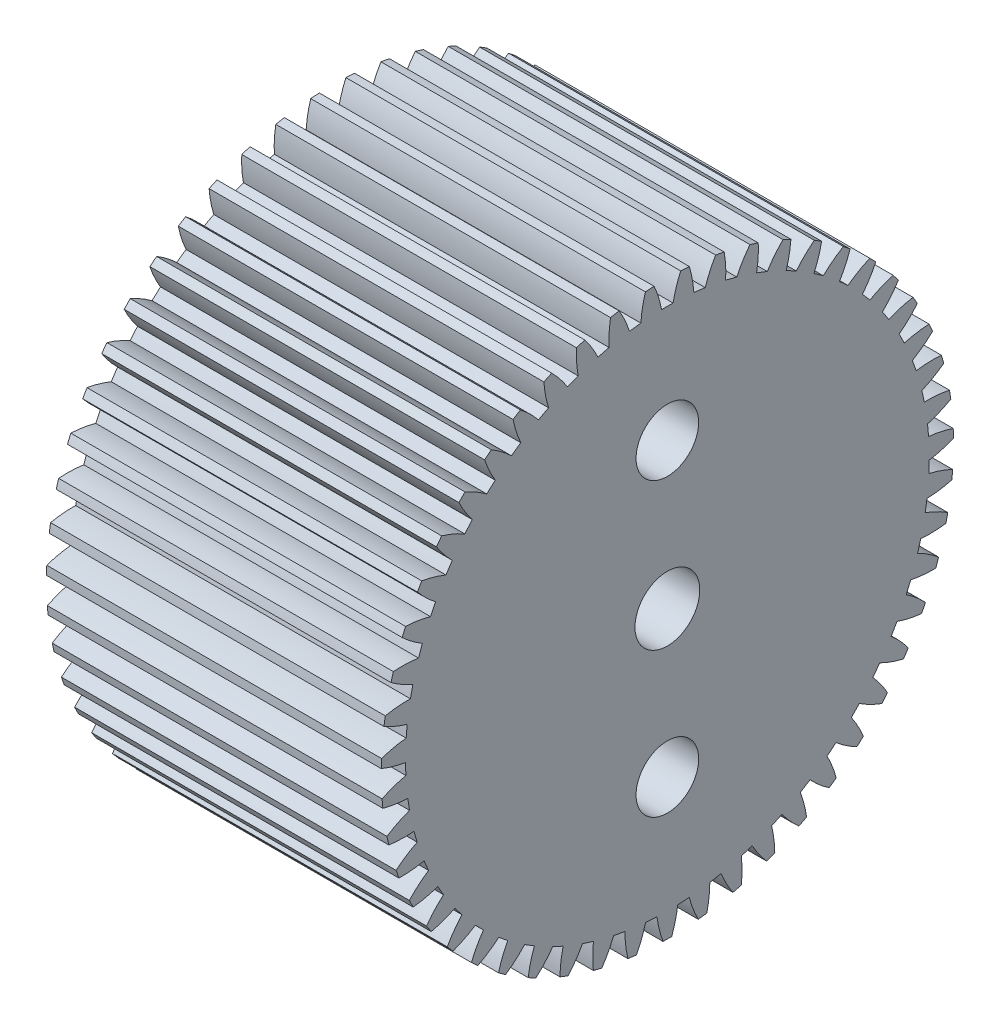
from build123d import *

# Parameters (mm, degrees)
BASPROSKE_W         = 8
BASPROSKE_H         = 13.25
TOOTHCUT_DEPTH      = 21.374616561
TEETHCUTS_COUNT     = 51
TEETHCUTS_ANGLE     = 352.941176471
BORSKE_R            = 1.5
BORE_DEPTH          = 50.0000508
CUT_EXTRUDE_1_REACH = 22.374
SKETCH_1_R          = 1.45
SKETCH_2_R          = 1.45
SKETCH_2_R_2        = 1.5
EXTRUDE_1_DEPTH     = 7.5


with BuildPart() as part:
    # BasProSke → Base-Revolve (revolve)
    with BuildSketch(Plane(origin=(0, 0, 0), x_dir=(1, 0, 0), z_dir=(0, 1, 0)), mode=Mode.PRIVATE) as base_revolve_sk:
        with Locations((4, 6.625)):
            Rectangle(BASPROSKE_W, BASPROSKE_H)
    revolve(base_revolve_sk.sketch.rotate(Axis((-10, 0, 0), (1, 0, 0)), 180), axis=Axis((-10, 0, 0), (1, 0, 0)))

    # TooCutSke → ToothCut (cut, through all)
    with BuildSketch(Plane(origin=(0, 0, 0), x_dir=(0, 0, -1), z_dir=(1, 0, 0))):
        with BuildLine():
            ThreePointArc((0.265457967, 12.121093518), (0, 12.124), (-0.265457967, 12.121093518))
            ThreePointArc((-0.265457967, 12.121093518), (-0.412560546, 12.701466693), (-0.626666111, 13.260600844))
            ThreePointArc((-0.626666111, 13.260600844), (0, 13.2754), (0.626666111, 13.260600844))
            ThreePointArc((0.626666111, 13.260600844), (0.412560546, 12.701466693), (0.265457967, 12.121093518))
        make_face()
    toothcut = extrude(amount=TOOTHCUT_DEPTH, mode=Mode.SUBTRACT)

    # TeethCuts: ToothCut ×51 about axis
    teethcuts_axis = Axis((-10, 0, 0), (1, 0, 0))
    for i in range(1, TEETHCUTS_COUNT):
        add(toothcut.rotate(teethcuts_axis, i * TEETHCUTS_ANGLE / (TEETHCUTS_COUNT - 1)), mode=Mode.SUBTRACT)

    # BorSke → Bore (cut, symmetric)
    with BuildSketch(Plane(origin=(0, 0, 0), x_dir=(0, 0, -1), z_dir=(1, 0, 0))):
        with Locations(Location((0, 0, 0), (0, 0, 180))):
            Circle(BORSKE_R)
    extrude(amount=BORE_DEPTH, both=True, mode=Mode.SUBTRACT)

    # 草圖1 → 除料-伸長1 (cut, up to next)
    with BuildSketch(Plane(origin=(8, 0, 0), x_dir=(0, 0, -1), z_dir=(1, 0, 0)), mode=Mode.PRIVATE) as cut_extrude_1_sk1:
        with Locations((0, 6.75)):
            Circle(SKETCH_1_R)
    cut_extrude_1_tool1 = extrude(cut_extrude_1_sk1.sketch, amount=-CUT_EXTRUDE_1_REACH, mode=Mode.PRIVATE) & part.part
    # 草圖1 → 除料-伸長1 (cut, up to next)
    with BuildSketch(Plane(origin=(8, 0, 0), x_dir=(0, 0, -1), z_dir=(1, 0, 0)), mode=Mode.PRIVATE) as cut_extrude_1_sk2:
        with Locations((0, -6.75)):
            Circle(SKETCH_1_R)
    cut_extrude_1_tool2 = extrude(cut_extrude_1_sk2.sketch, amount=-CUT_EXTRUDE_1_REACH, mode=Mode.PRIVATE) & part.part
    add(cut_extrude_1_tool1.solids().sort_by_distance((8, 6.75, 0))[0], mode=Mode.SUBTRACT)
    add(cut_extrude_1_tool2.solids().sort_by_distance((8, -6.75, 0))[0], mode=Mode.SUBTRACT)

    # 草圖2 → 填料-伸長1 (add)
    with BuildSketch(Plane.ZY):
        with BuildLine():
            ThreePointArc((12.123519516, -0.107937719), (12.695011661, 0.017518645), (13.248373473, 0.207606195))
            ThreePointArc((13.248373473, 0.207606195), (13.243715786, 0.408034526), (13.236026089, 0.608369441))
            ThreePointArc((13.236026089, 0.608369441), (12.672011861, 0.764031003), (12.093880441, 0.854067844))
            ThreePointArc((12.093880441, 0.854067844), (12.072281153, 1.11866159), (12.044893699, 1.382718984))
            ThreePointArc((12.044893699, 1.382718984), (12.596637106, 1.577454146), (13.122445184, 1.834102616))
            ThreePointArc((13.122445184, 1.834102616), (13.093192505, 2.032439427), (13.060942276, 2.230310932))
            ThreePointArc((13.060942276, 2.230310932), (12.482074005, 2.315481914), (11.897260054, 2.33379074))
            ThreePointArc((11.897260054, 2.33379074), (11.843309005, 2.593724701), (11.783679571, 2.852415076))
            ThreePointArc((11.783679571, 2.852415076), (12.307310374, 3.113477049), (12.797594002, 3.432795911))
            ThreePointArc((12.797594002, 3.432795911), (12.744189772, 3.626034618), (12.687867893, 3.818443183))
            ThreePointArc((12.687867893, 3.818443183), (12.102920632, 3.83183248), (11.520289331, 3.778135747))
            ThreePointArc((11.520289331, 3.778135747), (11.434804364, 4.029469589), (11.343836873, 4.278871464))
            ThreePointArc((11.343836873, 4.278871464), (11.831417361, 4.602302815), (12.27874434, 4.979451519))
            ThreePointArc((12.27874434, 4.979451519), (12.201998113, 5.164662821), (12.122458365, 5.348691727))
            ThreePointArc((12.122458365, 5.348691727), (11.540299318, 5.290096371), (10.968682766, 5.165208068))
            ThreePointArc((10.968682766, 5.165208068), (10.852959744, 5.404131825), (10.732033171, 5.640464522))
            ThreePointArc((10.732033171, 5.640464522), (11.176172122, 6.021362361), (11.573761431, 6.450623718))
            ThreePointArc((11.573761431, 6.450623718), (11.4748366, 6.625), (11.373284725, 6.797859557))
            ThreePointArc((11.373284725, 6.797859557), (10.802738831, 6.668167794), (10.250802151, 6.473981099))
            ThreePointArc((10.250802151, 6.473981099), (10.106595318, 6.696872932), (9.957542785, 6.916553888))
            ThreePointArc((9.957542785, 6.916553888), (10.351507505, 7.349144191), (10.693332095, 7.824011036))
            ThreePointArc((10.693332095, 7.824011036), (10.573728261, 7.984908932), (10.451703682, 8.143978766))
            ThreePointArc((10.451703682, 8.143978766), (9.901419834, 7.94515659), (9.377529824, 7.684615176))
            ThreePointArc((9.377529824, 7.684615176), (9.20702521, 7.888096272), (9.032106202, 8.087795346))
            ThreePointArc((9.032106202, 8.087795346), (9.369924587, 8.565520487), (9.650802746, 9.078794323))
            ThreePointArc((9.650802746, 9.078794323), (9.512332981, 9.223774784), (9.371685466, 9.366643557))
            ThreePointArc((9.371685466, 9.366643557), (8.850005406, 9.101704911), (8.362103704, 8.77875832))
            ThreePointArc((8.362103704, 8.77875832), (8.167885984, 8.959744112), (7.969752095, 9.136434072))
            ThreePointArc((7.969752095, 9.136434072), (8.246303163, 9.652052223), (8.461977064, 10.195952342))
            ThreePointArc((8.461977064, 10.195952342), (8.306740428, 10.322817612), (8.14960205, 10.447319581))
            ThreePointArc((8.14960205, 10.447319581), (7.664433917, 10.120280664), (7.219916616, 9.739824437))
            ThreePointArc((7.219916616, 9.739824437), (7.004929932, 9.895571365), (6.78658467, 10.04657377))
            ThreePointArc((6.78658467, 10.04657377), (6.997676188, 10.592268687), (7.144876436, 11.158550117))
            ThreePointArc((7.144876436, 11.158550117), (6.975226158, 11.265377048), (6.803978975, 11.369624889))
            ThreePointArc((6.803978975, 11.369624889), (6.362677422, 10.985443277), (5.968282951, 10.553244744))
            ThreePointArc((5.968282951, 10.553244744), (5.735786283, 10.681391844), (5.500539539, 10.804417651))
            ThreePointArc((5.500539539, 10.804417651), (5.642971576, 11.371917154), (5.719466764, 11.951995647))
            ThreePointArc((5.719466764, 11.951995647), (5.53797457, 12.037164852), (5.355214514, 12.119578273))
            ThreePointArc((5.355214514, 12.119578273), (4.964469224, 11.684077768), (4.626176201, 11.206688617))
            ThreePointArc((4.626176201, 11.206688617), (4.379693961, 11.305293309), (4.131111836, 11.398477574))
            ThreePointArc((4.131111836, 11.398477574), (4.202725267, 11.979178949), (4.207355805, 12.564261105))
            ThreePointArc((4.207355805, 12.564261105), (4.016772932, 12.626481506), (3.82527046, 12.685811204))
            ThreePointArc((3.82527046, 12.685811204), (3.491004732, 12.205593551), (3.213941335, 11.690250515))
            ThreePointArc((3.213941335, 11.690250515), (2.957209943, 11.757818052), (2.699060689, 11.819748195))
            ThreePointArc((2.699060689, 11.819748195), (2.698769927, 12.404848603), (2.631465622, 12.986065173))
            ThreePointArc((2.631465622, 12.986065173), (2.434681111, 13.024393571), (2.237339205, 13.059740169))
            ThreePointArc((2.237339205, 13.059740169), (1.964620168, 12.542084977), (1.752986394, 11.996600131))
            ThreePointArc((1.752986394, 11.996600131), (1.489897636, 12.032106259), (1.226094533, 12.061843483))
            ThreePointArc((1.226094533, 12.061843483), (1.153903986, 12.642473396), (1.015685102, 13.21101373))
            ThreePointArc((1.015685102, 13.21101373), (0.815682006, 13.224869106), (0.615492168, 13.235696785))
            ThreePointArc((0.615492168, 13.235696785), (0.408453964, 12.688451179), (0.265457967, 12.121093518))
            ThreePointArc((0.265457967, 12.121093518), (0, 12.124), (-0.265457967, 12.121093518))
            ThreePointArc((-0.265457967, 12.121093518), (-0.408453964, 12.688451179), (-0.615492168, 13.235696785))
            ThreePointArc((-0.615492168, 13.235696785), (-0.815682006, 13.224869106), (-1.015685102, 13.21101373))
            ThreePointArc((-1.015685102, 13.21101373), (-1.153903986, 12.642473396), (-1.226094533, 12.061843483))
            ThreePointArc((-1.226094533, 12.061843483), (-1.489897636, 12.032106259), (-1.752986394, 11.996600131))
            ThreePointArc((-1.752986394, 11.996600131), (-1.964620168, 12.542084977), (-2.237339205, 13.059740169))
            ThreePointArc((-2.237339205, 13.059740169), (-2.434681111, 13.024393571), (-2.631465622, 12.986065173))
            ThreePointArc((-2.631465622, 12.986065173), (-2.698769927, 12.404848603), (-2.699060689, 11.819748195))
            ThreePointArc((-2.699060689, 11.819748195), (-2.957209943, 11.757818052), (-3.213941335, 11.690250515))
            ThreePointArc((-3.213941335, 11.690250515), (-3.491004732, 12.205593551), (-3.82527046, 12.685811204))
            ThreePointArc((-3.82527046, 12.685811204), (-4.016772932, 12.626481506), (-4.207355805, 12.564261105))
            ThreePointArc((-4.207355805, 12.564261105), (-4.202725267, 11.979178949), (-4.131111836, 11.398477574))
            ThreePointArc((-4.131111836, 11.398477574), (-4.379693961, 11.305293309), (-4.626176201, 11.206688617))
            ThreePointArc((-4.626176201, 11.206688617), (-4.964469224, 11.684077768), (-5.355214514, 12.119578273))
            ThreePointArc((-5.355214514, 12.119578273), (-5.53797457, 12.037164852), (-5.719466764, 11.951995647))
            ThreePointArc((-5.719466764, 11.951995647), (-5.642971576, 11.371917154), (-5.500539539, 10.804417651))
            ThreePointArc((-5.500539539, 10.804417651), (-5.735786283, 10.681391844), (-5.968282951, 10.553244744))
            ThreePointArc((-5.968282951, 10.553244744), (-6.362677422, 10.985443277), (-6.803978975, 11.369624889))
            ThreePointArc((-6.803978975, 11.369624889), (-6.975226158, 11.265377048), (-7.144876436, 11.158550117))
            ThreePointArc((-7.144876436, 11.158550117), (-6.997676188, 10.592268687), (-6.78658467, 10.04657377))
            ThreePointArc((-6.78658467, 10.04657377), (-7.004929932, 9.895571365), (-7.219916616, 9.739824437))
            ThreePointArc((-7.219916616, 9.739824437), (-7.664433917, 10.120280664), (-8.14960205, 10.447319581))
            ThreePointArc((-8.14960205, 10.447319581), (-8.306740428, 10.322817612), (-8.461977064, 10.195952342))
            ThreePointArc((-8.461977064, 10.195952342), (-8.246303163, 9.652052223), (-7.969752095, 9.136434072))
            ThreePointArc((-7.969752095, 9.136434072), (-8.167885984, 8.959744112), (-8.362103704, 8.77875832))
            ThreePointArc((-8.362103704, 8.77875832), (-8.850005406, 9.101704911), (-9.371685466, 9.366643557))
            ThreePointArc((-9.371685466, 9.366643557), (-9.512332981, 9.223774784), (-9.650802746, 9.078794323))
            ThreePointArc((-9.650802746, 9.078794323), (-9.369924587, 8.565520487), (-9.032106202, 8.087795346))
            ThreePointArc((-9.032106202, 8.087795346), (-9.20702521, 7.888096272), (-9.377529824, 7.684615176))
            ThreePointArc((-9.377529824, 7.684615176), (-9.901419834, 7.94515659), (-10.451703682, 8.143978766))
            ThreePointArc((-10.451703682, 8.143978766), (-10.573728261, 7.984908932), (-10.693332095, 7.824011036))
            ThreePointArc((-10.693332095, 7.824011036), (-10.351507505, 7.349144191), (-9.957542785, 6.916553888))
            ThreePointArc((-9.957542785, 6.916553888), (-10.106595318, 6.696872932), (-10.250802151, 6.473981099))
            ThreePointArc((-10.250802151, 6.473981099), (-10.802738831, 6.668167794), (-11.373284725, 6.797859557))
            ThreePointArc((-11.373284725, 6.797859557), (-11.4748366, 6.625), (-11.573761431, 6.450623718))
            ThreePointArc((-11.573761431, 6.450623718), (-11.176172122, 6.021362361), (-10.732033171, 5.640464522))
            ThreePointArc((-10.732033171, 5.640464522), (-10.852959744, 5.404131825), (-10.968682766, 5.165208068))
            ThreePointArc((-10.968682766, 5.165208068), (-11.540299318, 5.290096371), (-12.122458365, 5.348691727))
            ThreePointArc((-12.122458365, 5.348691727), (-12.201998113, 5.164662821), (-12.27874434, 4.979451519))
            ThreePointArc((-12.27874434, 4.979451519), (-11.831417361, 4.602302815), (-11.343836873, 4.278871464))
            ThreePointArc((-11.343836873, 4.278871464), (-11.434804364, 4.029469589), (-11.520289331, 3.778135747))
            ThreePointArc((-11.520289331, 3.778135747), (-12.102920632, 3.83183248), (-12.687867893, 3.818443183))
            ThreePointArc((-12.687867893, 3.818443183), (-12.744189772, 3.626034618), (-12.797594002, 3.432795911))
            ThreePointArc((-12.797594002, 3.432795911), (-12.307310374, 3.113477049), (-11.783679571, 2.852415076))
            ThreePointArc((-11.783679571, 2.852415076), (-11.843309005, 2.593724701), (-11.897260054, 2.33379074))
            ThreePointArc((-11.897260054, 2.33379074), (-12.482074005, 2.315481914), (-13.060942276, 2.230310932))
            ThreePointArc((-13.060942276, 2.230310932), (-13.093192505, 2.032439427), (-13.122445184, 1.834102616))
            ThreePointArc((-13.122445184, 1.834102616), (-12.596637106, 1.577454146), (-12.044893699, 1.382718984))
            ThreePointArc((-12.044893699, 1.382718984), (-12.072281153, 1.11866159), (-12.093880441, 0.854067844))
            ThreePointArc((-12.093880441, 0.854067844), (-12.672011861, 0.764031003), (-13.236026089, 0.608369441))
            ThreePointArc((-13.236026089, 0.608369441), (-13.243715786, 0.408034526), (-13.248373473, 0.207606195))
            ThreePointArc((-13.248373473, 0.207606195), (-12.695011661, 0.017518645), (-12.123519516, -0.107937719))
            ThreePointArc((-12.123519516, -0.107937719), (-12.118249826, -0.37335929), (-12.107169928, -0.63860185))
            ThreePointArc((-12.107169928, -0.63860185), (-12.669854933, -0.799001839), (-13.210465238, -1.02279431))
            ThreePointArc((-13.210465238, -1.02279431), (-13.193477836, -1.222555763), (-13.173469924, -1.422037324))
            ThreePointArc((-13.173469924, -1.422037324), (-12.600942779, -1.54268242), (-12.018365135, -1.596958197))
            ThreePointArc((-12.018365135, -1.596958197), (-11.980518184, -1.859720424), (-11.936927061, -2.121590991))
            ThreePointArc((-11.936927061, -2.121590991), (-12.47563592, -2.349922628), (-12.9846472, -2.638453542))
            ThreePointArc((-12.9846472, -2.638453542), (-12.94324021, -2.834613352), (-12.89887, -3.030124207))
            ThreePointArc((-12.89887, -3.030124207), (-12.31585645, -3.079497993), (-11.73102459, -3.061770415))
            ThreePointArc((-11.73102459, -3.061770415), (-11.661174098, -3.317890092), (-11.585732548, -3.572418975))
            ThreePointArc((-11.585732548, -3.572418975), (-12.092298983, -3.865220986), (-12.561995146, -4.214116509))
            ThreePointArc((-12.561995146, -4.214116509), (-12.496796257, -4.403701093), (-12.428736356, -4.592277496))
            ThreePointArc((-12.428736356, -4.592277496), (-11.84407429, -4.569631515), (-11.26585367, -4.480169316))
            ThreePointArc((-11.26585367, -4.480169316), (-11.1650585, -4.725763928), (-11.058910139, -4.969092729))
            ThreePointArc((-11.058910139, -4.969092729), (-11.52565512, -5.321926533), (-11.948916051, -5.725897764))
            ThreePointArc((-11.948916051, -5.725897764), (-11.86091361, -5.906033214), (-11.770195737, -6.084816539))
            ThreePointArc((-11.770195737, -6.084816539), (-11.192748038, -5.990494081), (-10.629903891, -5.830653416))
            ThreePointArc((-10.629903891, -5.830653416), (-10.499691995, -6.062), (-10.364445925, -6.290440102))
            ThreePointArc((-10.364445925, -6.290440102), (-10.784294074, -6.697957099), (-11.154703569, -7.150880246))
            ThreePointArc((-11.154703569, -7.150880246), (-11.045231604, -7.318835892), (-10.933230949, -7.485115966))
            ThreePointArc((-10.933230949, -7.485115966), (-10.371751135, -7.320546863), (-9.832815606, -7.092750754))
            ThreePointArc((-9.832815606, -7.092750754), (-9.675160864, -7.306342331), (-9.512867275, -7.516430815))
            ThreePointArc((-9.512867275, -7.516430815), (-9.879454123, -7.972453462), (-10.191397151, -8.467462673))
            ThreePointArc((-10.191397151, -8.467462673), (-10.062115146, -8.620692478), (-9.930529524, -8.771948664))
            ThreePointArc((-9.930529524, -8.771948664), (-9.393529056, -8.539627617), (-8.886671859, -8.247329221))
            ThreePointArc((-8.886671859, -8.247329221), (-8.703964155, -8.439927961), (-8.517083255, -8.628480099))
            ThreePointArc((-8.517083255, -8.628480099), (-8.824851717, -9.126095558), (-9.07359954, -9.655686997))
            ThreePointArc((-9.07359954, -9.655686997), (-8.926467278, -9.791868153), (-8.777291394, -9.925807563))
            ThreePointArc((-8.777291394, -9.925807563), (-8.272910653, -9.629256321), (-7.805815225, -9.276886583))
            ThreePointArc((-7.805815225, -9.276886583), (-7.600824223, -9.445572886), (-7.392188935, -9.609730421))
            ThreePointArc((-7.392188935, -9.609730421), (-7.636473555, -10.141395348), (-7.81825541, -10.697540948))
            ThreePointArc((-7.81825541, -10.697540948), (-7.655503266, -10.814609089), (-7.490998474, -10.929201337))
            ThreePointArc((-7.490998474, -10.929201337), (-7.026883357, -10.572915315), (-6.606630389, -10.165815801))
            ThreePointArc((-6.606630389, -10.165815801), (-6.382463543, -10.308032554), (-6.155236565, -10.445307024))
            ThreePointArc((-6.155236565, -10.445307024), (-6.332334239, -11.002961922), (-6.444394497, -11.577231084))
            ThreePointArc((-6.444394497, -11.577231084), (-6.268489628, -11.673411574), (-6.091149653, -11.766919559))
            ThreePointArc((-6.091149653, -11.766919559), (-5.674335672, -11.35629969), (-5.307295771, -10.900641614))
            ThreePointArc((-5.307295771, -10.900641614), (-5.067351221, -11.014232956), (-4.824977083, -11.122543421))
            ThreePointArc((-4.824977083, -11.122543421), (-4.93220319, -11.697734809), (-4.972843133, -12.281422197))
            ThreePointArc((-4.972843133, -12.281422197), (-4.786452077, -12.35525704), (-4.598965212, -12.426263275))
            ThreePointArc((-4.598965212, -12.426263275), (-4.235770843, -11.967534138), (-3.927507959, -11.470224812))
            ThreePointArc((-3.927507959, -11.470224812), (-3.675423021, -11.553468813), (-3.421575867, -11.631173397))
            ThreePointArc((-3.421575867, -11.631173397), (-3.457304968, -12.215181961), (-3.425908536, -12.799439468))
            ThreePointArc((-3.425908536, -12.799439468), (-3.231856791, -12.849809402), (-3.037065147, -12.897237506))
            ThreePointArc((-3.037065147, -12.897237506), (-2.732996045, -12.397352967), (-2.48818313, -11.865931093))
            ThreePointArc((-2.48818313, -11.865931093), (-2.227779154, -11.917565861), (-1.966307049, -11.96348664))
            ThreePointArc((-1.966307049, -11.96348664), (-1.929997527, -12.547459405), (-1.827040658, -13.123430285))
            ThreePointArc((-1.827040658, -13.123430285), (-1.628269851, -13.149571753), (-1.429126269, -13.172702764))
            ThreePointArc((-1.429126269, -13.172702764), (-1.188791813, -12.639240563), (-1.011139981, -12.081761955))
            ThreePointArc((-1.011139981, -12.081761955), (-0.746364426, -12.101004758), (-0.48123102, -12.114445621))
            ThreePointArc((-0.48123102, -12.114445621), (-0.373433291, -12.689530155), (-0.200476705, -13.248483275))
            ThreePointArc((-0.200476705, -13.248483275), (0, -13.25), (0.200476705, -13.248483275))
            ThreePointArc((0.200476705, -13.248483275), (0.373433291, -12.689530155), (0.48123102, -12.114445621))
            ThreePointArc((0.48123102, -12.114445621), (0.746364426, -12.101004758), (1.011139981, -12.081761955))
            ThreePointArc((1.011139981, -12.081761955), (1.188791813, -12.639240563), (1.429126269, -13.172702764))
            ThreePointArc((1.429126269, -13.172702764), (1.628269851, -13.149571753), (1.827040658, -13.123430285))
            ThreePointArc((1.827040658, -13.123430285), (1.929997527, -12.547459405), (1.966307049, -11.96348664))
            ThreePointArc((1.966307049, -11.96348664), (2.227779154, -11.917565861), (2.48818313, -11.865931093))
            ThreePointArc((2.48818313, -11.865931093), (2.732996045, -12.397352967), (3.037065147, -12.897237506))
            ThreePointArc((3.037065147, -12.897237506), (3.231856791, -12.849809402), (3.425908536, -12.799439468))
            ThreePointArc((3.425908536, -12.799439468), (3.457304968, -12.215181961), (3.421575867, -11.631173397))
            ThreePointArc((3.421575867, -11.631173397), (3.675423021, -11.553468813), (3.927507959, -11.470224812))
            ThreePointArc((3.927507959, -11.470224812), (4.235770843, -11.967534138), (4.598965212, -12.426263275))
            ThreePointArc((4.598965212, -12.426263275), (4.786452077, -12.35525704), (4.972843133, -12.281422197))
            ThreePointArc((4.972843133, -12.281422197), (4.93220319, -11.697734809), (4.824977083, -11.122543421))
            ThreePointArc((4.824977083, -11.122543421), (5.067351221, -11.014232956), (5.307295771, -10.900641614))
            ThreePointArc((5.307295771, -10.900641614), (5.674335672, -11.35629969), (6.091149653, -11.766919559))
            ThreePointArc((6.091149653, -11.766919559), (6.268489628, -11.673411574), (6.444394497, -11.577231084))
            ThreePointArc((6.444394497, -11.577231084), (6.332334239, -11.002961922), (6.155236565, -10.445307024))
            ThreePointArc((6.155236565, -10.445307024), (6.382463543, -10.308032554), (6.606630389, -10.165815801))
            ThreePointArc((6.606630389, -10.165815801), (7.026883357, -10.572915315), (7.490998474, -10.929201337))
            ThreePointArc((7.490998474, -10.929201337), (7.655503266, -10.814609089), (7.81825541, -10.697540948))
            ThreePointArc((7.81825541, -10.697540948), (7.636473555, -10.141395348), (7.392188935, -9.609730421))
            ThreePointArc((7.392188935, -9.609730421), (7.600824223, -9.445572886), (7.805815225, -9.276886583))
            ThreePointArc((7.805815225, -9.276886583), (8.272910653, -9.629256321), (8.777291394, -9.925807563))
            ThreePointArc((8.777291394, -9.925807563), (8.926467278, -9.791868153), (9.07359954, -9.655686997))
            ThreePointArc((9.07359954, -9.655686997), (8.824851717, -9.126095558), (8.517083255, -8.628480099))
            ThreePointArc((8.517083255, -8.628480099), (8.703964155, -8.439927961), (8.886671859, -8.247329221))
            ThreePointArc((8.886671859, -8.247329221), (9.393529056, -8.539627617), (9.930529524, -8.771948664))
            ThreePointArc((9.930529524, -8.771948664), (10.062115146, -8.620692478), (10.191397151, -8.467462673))
            ThreePointArc((10.191397151, -8.467462673), (9.879454123, -7.972453462), (9.512867275, -7.516430815))
            ThreePointArc((9.512867275, -7.516430815), (9.675160864, -7.306342331), (9.832815606, -7.092750754))
            ThreePointArc((9.832815606, -7.092750754), (10.371751135, -7.320546863), (10.933230949, -7.485115966))
            ThreePointArc((10.933230949, -7.485115966), (11.045231604, -7.318835892), (11.154703569, -7.150880246))
            ThreePointArc((11.154703569, -7.150880246), (10.784294074, -6.697957099), (10.364445925, -6.290440102))
            ThreePointArc((10.364445925, -6.290440102), (10.499691995, -6.062), (10.629903891, -5.830653416))
            ThreePointArc((10.629903891, -5.830653416), (11.192748038, -5.990494081), (11.770195737, -6.084816539))
            ThreePointArc((11.770195737, -6.084816539), (11.86091361, -5.906033214), (11.948916051, -5.725897764))
            ThreePointArc((11.948916051, -5.725897764), (11.52565512, -5.321926533), (11.058910139, -4.969092729))
            ThreePointArc((11.058910139, -4.969092729), (11.1650585, -4.725763928), (11.26585367, -4.480169316))
            ThreePointArc((11.26585367, -4.480169316), (11.84407429, -4.569631515), (12.428736356, -4.592277496))
            ThreePointArc((12.428736356, -4.592277496), (12.496796257, -4.403701093), (12.561995146, -4.214116509))
            ThreePointArc((12.561995146, -4.214116509), (12.092298983, -3.865220986), (11.585732548, -3.572418975))
            ThreePointArc((11.585732548, -3.572418975), (11.661174098, -3.317890092), (11.73102459, -3.061770415))
            ThreePointArc((11.73102459, -3.061770415), (12.31585645, -3.079497993), (12.89887, -3.030124207))
            ThreePointArc((12.89887, -3.030124207), (12.94324021, -2.834613352), (12.9846472, -2.638453542))
            ThreePointArc((12.9846472, -2.638453542), (12.47563592, -2.349922628), (11.936927061, -2.121590991))
            ThreePointArc((11.936927061, -2.121590991), (11.980518184, -1.859720424), (12.018365135, -1.596958197))
            ThreePointArc((12.018365135, -1.596958197), (12.600942779, -1.54268242), (13.173469924, -1.422037324))
            ThreePointArc((13.173469924, -1.422037324), (13.193477836, -1.222555763), (13.210465238, -1.02279431))
            ThreePointArc((13.210465238, -1.02279431), (12.669854933, -0.799001839), (12.107169928, -0.63860185))
            ThreePointArc((12.107169928, -0.63860185), (12.118249826, -0.37335929), (12.123519516, -0.107937719))
        make_face()
        with Locations(Location((0, 6.75, 0), (0, 0, 180))):
            Circle(SKETCH_2_R, mode=Mode.SUBTRACT)
        Circle(SKETCH_2_R_2, mode=Mode.SUBTRACT)
        with Locations(Location((0, -6.75, 0), (0, 0, 180))):
            Circle(SKETCH_2_R, mode=Mode.SUBTRACT)
    extrude(amount=EXTRUDE_1_DEPTH)


solid = part.part
